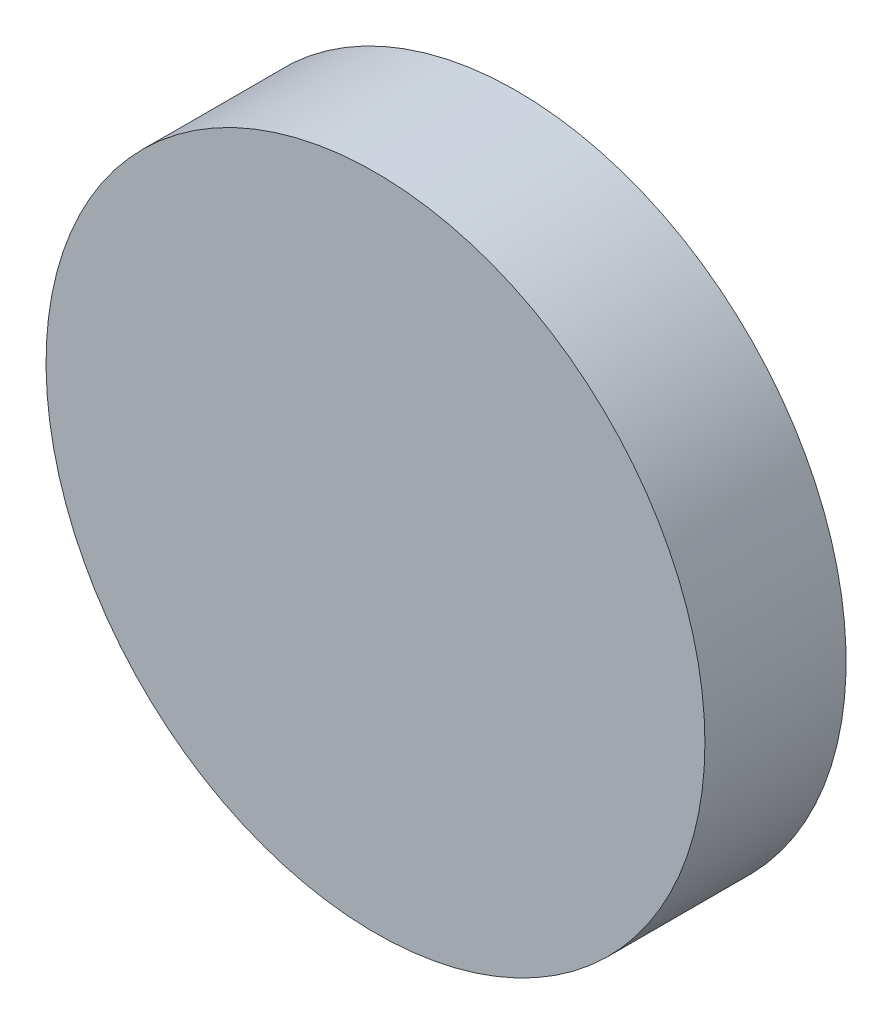
from build123d import *
from build123d.topology import SkipClean

# Parameters (mm, degrees)
SKETCH1_R           = 10.85
BOSS_EXTRUDE1_DEPTH = 2
SKETCH2_R           = 14
BOSS_EXTRUDE2_DEPTH = 1
BOSS_EXTRUDE3_START = 5
BOSS_EXTRUDE3_DEPTH = 5


with BuildPart() as part:
    # Sketch1 → Boss-Extrude1 (new body)
    with BuildSketch(Plane.XY):
        Circle(SKETCH1_R)
    extrude(amount=BOSS_EXTRUDE1_DEPTH)

    # Sketch2 → Boss-Extrude2 (add)
    with BuildSketch(Plane.XY.offset(2)):
        Circle(SKETCH2_R)
    extrude(amount=BOSS_EXTRUDE2_DEPTH)

    # Sketch3 → Boss-Extrude3 (add)
    with SkipClean():  # the faces are left unmerged after this step: merging them gives an invalid solid
        with BuildSketch(Plane(origin=(0, 0, 2), x_dir=(-1, 0, 0), z_dir=(0, 0, -1)).offset(BOSS_EXTRUDE3_START)):
            with BuildLine():
                ThreePointArc((8.627279255, -9.251624325), (-12.65, 0), (8.627279255, 9.251624325))
                Line((8.627279255, 9.251624325), (9.547977041, 10.238951823))
                ThreePointArc((9.547977041, 10.238951823), (-14, 0), (9.547977041, -10.238951823))
                Line((9.547977041, -10.238951823), (8.627279255, -9.251624325))
            make_face()
        extrude(amount=-BOSS_EXTRUDE3_DEPTH)


solid = part.part
